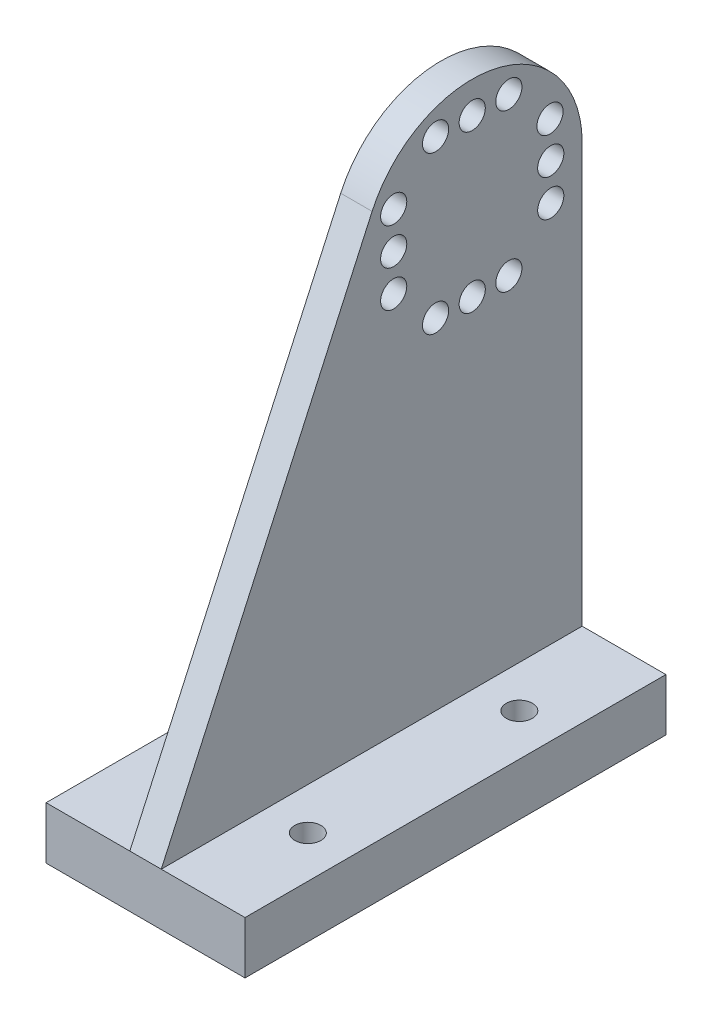
from build123d import *

# Parameters (mm, degrees)
SKETCH1_R           = 1.25
BOSS_EXTRUDE1_DEPTH = 3
SKETCH2_W           = 3
SKETCH2_H           = 40.2
BOSS_EXTRUDE2_DEPTH = 5
SKETCH4_W           = 40.2
SKETCH4_H           = 5
BOSS_EXTRUDE3_DEPTH = 8
SKETCH7_W           = 40.2
SKETCH7_H           = 5
BOSS_EXTRUDE4_DEPTH = 8
SKETCH8_R           = 1.25
CUT_EXTRUDE1_DEPTH  = 8


with BuildPart() as part:
    # Sketch1 → Boss-Extrude1 (new body)
    # profile 1 of 2: a face of its own
    with BuildSketch(Plane(origin=(0, 0, 0), x_dir=(0, 0, -1), z_dir=(1, 0, 0))):
        with BuildLine():
            Line((10.5, -40), (10.5, 0))
            ThreePointArc((10.5, 0), (-2.221347256, -10.262339712), (-9.560117404, 4.342137172))
            Line((-9.560117404, 4.342137172), (-29.7, -40))
            Line((-29.7, -40), (10.5, -40))
        make_face()
    # profile 2 of 2: a face of its own
    with BuildSketch(Plane(origin=(0, 0, 0), x_dir=(0, 0, -1), z_dir=(1, 0, 0))):
        with BuildLine():
            ThreePointArc((-9.560117404, 4.342137172), (-2.221347256, -10.262339712), (10.5, 0))
            ThreePointArc((10.5, 0), (2.221347256, 10.262339712), (-9.560117404, 4.342137172))
        make_face()
        with Locations((-7.5, -3.5)):
            Circle(SKETCH1_R, mode=Mode.SUBTRACT)
        with Locations((-3.5, -7.5)):
            Circle(SKETCH1_R, mode=Mode.SUBTRACT)
        with Locations((0, -7.5)):
            Circle(SKETCH1_R, mode=Mode.SUBTRACT)
        with Locations((3.5, -7.5)):
            Circle(SKETCH1_R, mode=Mode.SUBTRACT)
        with Locations((7.5, -3.5)):
            Circle(SKETCH1_R, mode=Mode.SUBTRACT)
        with Locations((-7.5, 0)):
            Circle(SKETCH1_R, mode=Mode.SUBTRACT)
        with Locations((-7.5, 3.5)):
            Circle(SKETCH1_R, mode=Mode.SUBTRACT)
        with Locations((-3.5, 7.5)):
            Circle(SKETCH1_R, mode=Mode.SUBTRACT)
        with Locations((0, 7.5)):
            Circle(SKETCH1_R, mode=Mode.SUBTRACT)
        with Locations((7.5, 0)):
            Circle(SKETCH1_R, mode=Mode.SUBTRACT)
        with Locations((7.428270452, 3.499264905)):
            Circle(SKETCH1_R, mode=Mode.SUBTRACT)
        with Locations((3.5, 7.5)):
            Circle(SKETCH1_R, mode=Mode.SUBTRACT)
    extrude(amount=BOSS_EXTRUDE1_DEPTH)

    # Sketch2 → Boss-Extrude2 (add)
    with BuildSketch(Plane(origin=(0, -40, 0), x_dir=(-1, 0, 0), z_dir=(0, -1, 0))):
        with Locations((-1.5, -9.6)):
            Rectangle(SKETCH2_W, SKETCH2_H)
    extrude(amount=BOSS_EXTRUDE2_DEPTH)

    # Sketch4 → Boss-Extrude3 (add)
    with BuildSketch(Plane.ZY):
        with Locations((9.6, -42.5)):
            Rectangle(SKETCH4_W, SKETCH4_H)
    extrude(amount=BOSS_EXTRUDE3_DEPTH)


with BuildPart() as body_2:
    # Mirror1: mirrored copy
    add(part.part.mirror(Plane(origin=(3, 0, 0), x_dir=(0, 0, 1), z_dir=(1, 0, 0))))


with BuildPart() as body_2_2:
    # Mirror2: mirrored copy
    add(body_2.part.mirror(Plane(origin=(3, -22.468969245, 5.63020619), x_dir=(0, 0, 1), z_dir=(-1, 0, 0))))

    # Sketch7 → Boss-Extrude4 (add)
    with BuildSketch(Plane(origin=(3, 0, 0), x_dir=(0, 0, -1), z_dir=(1, 0, 0))):
        with Locations((-9.6, -42.5)):
            Rectangle(SKETCH7_W, SKETCH7_H)
    extrude(amount=BOSS_EXTRUDE4_DEPTH)

    # Sketch8 → Cut-Extrude1 (cut)
    with BuildSketch(Plane(origin=(0, -40, 0), x_dir=(1, 0, 0), z_dir=(0, 1, 0))):
        with Locations(Location((7, 0.5, 0), (0, 0, 270))):
            Circle(SKETCH8_R)
        with Locations(Location((7, -19.7, 0), (0, 0, 270))):
            Circle(SKETCH8_R)
    extrude(amount=-CUT_EXTRUDE1_DEPTH, mode=Mode.SUBTRACT)


solid = body_2_2.part
